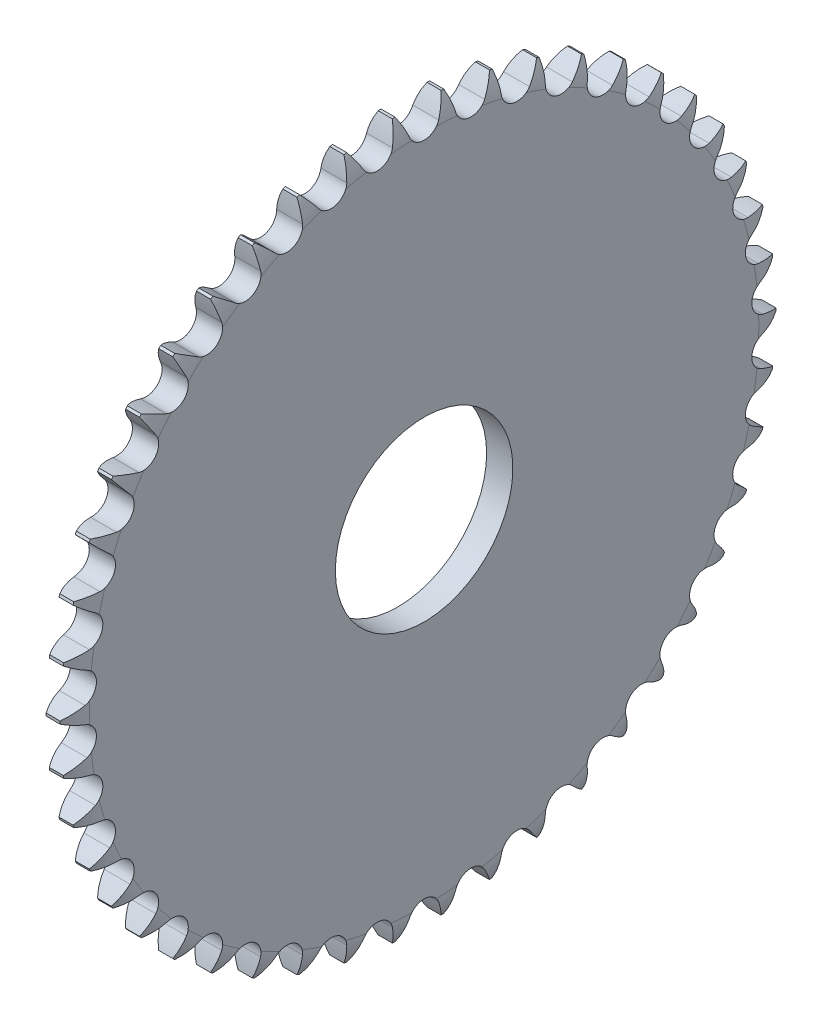
from build123d import *

# Parameters (mm, degrees)
TOOTHCUT_DEPTH  = 103.761746752
TEETHCUTS_COUNT = 46
TEETHCUTS_ANGLE = 352.173913043
BORSKE_R        = 18
BORE_DEPTH      = 50.0005


with BuildPart() as part:
    # BasProSke → Base-Revolve (revolve)
    with BuildSketch(Plane(origin=(0, 0, 0), x_dir=(1, 0, 0), z_dir=(0, 1, 0)), mode=Mode.PRIVATE) as base_revolve_sk:
        with BuildLine():
            Line((0, 0), (0, 67.870225967))
            ThreePointArc((0, 67.870225967), (0.314698702, 70.298388853), (1.238, 72.566102456))
            Line((1.238, 72.566102456), (4.0816, 72.566102456))
            ThreePointArc((4.0816, 72.566102456), (5.004901298, 70.298388853), (5.3196, 67.870225967))
            Line((5.3196, 67.870225967), (5.3196, 0))
            Line((5.3196, 0), (0, 0))
        make_face()
    revolve(base_revolve_sk.sketch.rotate(Axis((-10, 0, 0), (1, 0, 0)), 180), axis=Axis((-10, 0, 0), (1, 0, 0)))

    # TooCutSke → ToothCut (cut, through all)
    with BuildSketch(Plane(origin=(0, 0, 0), x_dir=(0, 0, -1), z_dir=(1, 0, 0))):
        with BuildLine():
            ThreePointArc((2.994194845, 68.671667007), (3.89579032, 70.816393679), (4.931914672, 72.899461903))
            ThreePointArc((4.931914672, 72.899461903), (0, 73.066102456), (-4.931914672, 72.899461903))
            ThreePointArc((-4.931914672, 72.899461903), (-3.89579032, 70.816393679), (-2.994194845, 68.671667007))
            ThreePointArc((-2.994194845, 68.671667007), (0, 66.612977456), (2.994194845, 68.671667007))
        make_face()
    toothcut = extrude(amount=TOOTHCUT_DEPTH, mode=Mode.SUBTRACT)

    # TeethCuts: ToothCut ×46 about axis
    teethcuts_axis = Axis((-10, 0, 0), (1, 0, 0))
    for i in range(1, TEETHCUTS_COUNT):
        add(toothcut.rotate(teethcuts_axis, i * TEETHCUTS_ANGLE / (TEETHCUTS_COUNT - 1)), mode=Mode.SUBTRACT)

    # BorSke → Bore (cut, symmetric)
    with BuildSketch(Plane(origin=(0, 0, 0), x_dir=(0, 0, -1), z_dir=(1, 0, 0))):
        with Locations(Location((0, 0, 0), (0, 0, 180))):
            Circle(BORSKE_R)
    extrude(amount=BORE_DEPTH, both=True, mode=Mode.SUBTRACT)


solid = part.part
